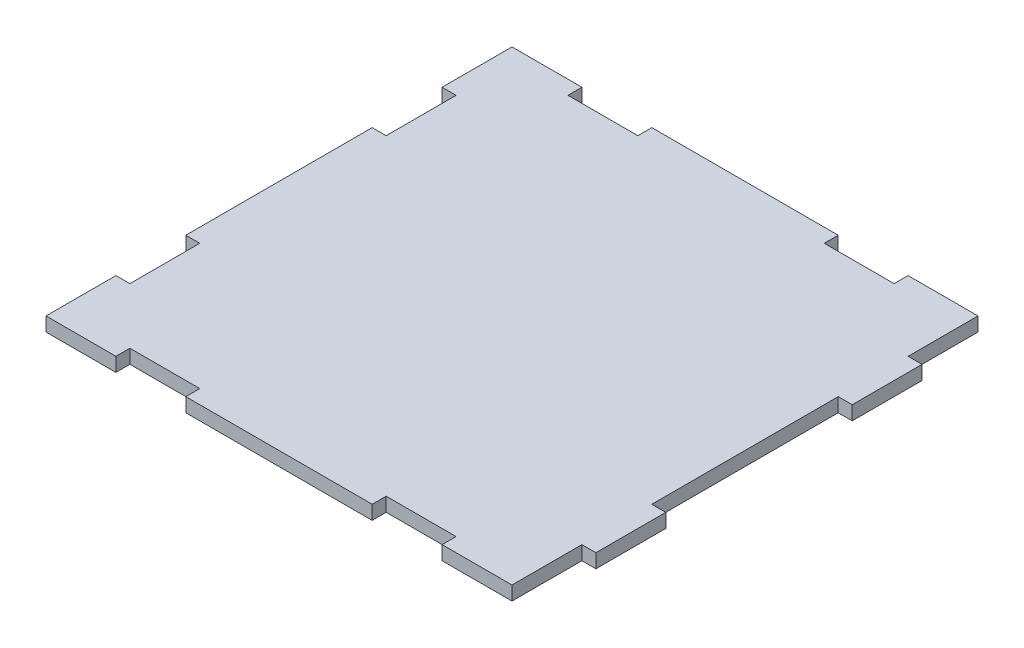
from build123d import *

# Parameters (mm, degrees)
RESSALTO_EXTRUS_O1_DEPTH = 6
ESBO_O2_W                = 30
ESBO_O2_H                = 6
ESBO_O2_W_2              = 6
ESBO_O2_H_2              = 30
CORTE_EXTRUS_O1_DEPTH    = 10


with BuildPart() as part:
    # Esboço1 → Ressalto-extrusão1 (new body)
    with BuildSketch(Plane(origin=(0, 0, 0), x_dir=(1, 0, 0), z_dir=(0, 1, 0))):
        Polygon((100, 70), (100, 100), (-100, 100), (-100, -100), (100, -100), (100, -70), (106, -70), (106, -40), (100, -40), (100, 40), (106, 40), (106, 70), align=None)
    extrude(amount=RESSALTO_EXTRUS_O1_DEPTH)

    # Esboço2 → Corte-extrusão1 (cut)
    with BuildSketch(Plane(origin=(0, 6, 0), x_dir=(1, 0, 0), z_dir=(0, 1, 0))):
        with Locations((-55, -97)):
            Rectangle(ESBO_O2_W, ESBO_O2_H)
        with Locations((55, -97)):
            Rectangle(ESBO_O2_W, ESBO_O2_H)
        with Locations((-55, 97)):
            Rectangle(ESBO_O2_W, ESBO_O2_H)
        with Locations((55, 97)):
            Rectangle(ESBO_O2_W, ESBO_O2_H)
        with Locations((-97, 55)):
            Rectangle(ESBO_O2_W_2, ESBO_O2_H_2)
        with Locations((-97, -55)):
            Rectangle(ESBO_O2_W_2, ESBO_O2_H_2)
    extrude(amount=-CORTE_EXTRUS_O1_DEPTH, mode=Mode.SUBTRACT)


solid = part.part
